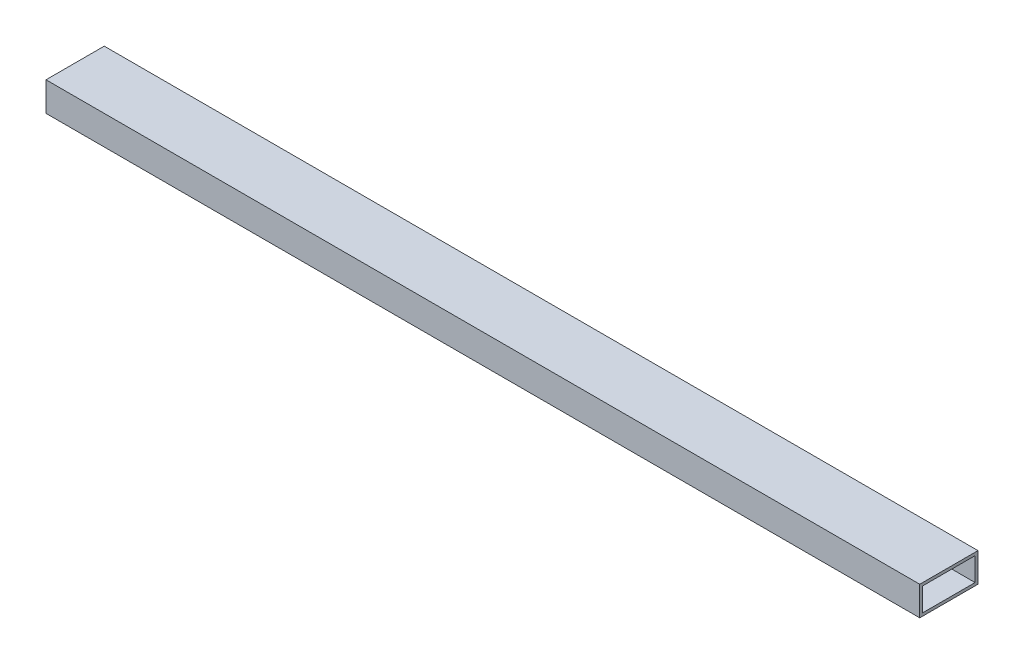
from build123d import *

# Parameters (mm, degrees)
SKETCH1_W           = 20
SKETCH1_H           = 10
SKETCH1_W_2         = 18
SKETCH1_H_2         = 8
BOSS_EXTRUDE1_DEPTH = 300


with BuildPart() as part:
    # Sketch1 → Boss-Extrude1 (new body)
    with BuildSketch(Plane(origin=(0, 0, 0), x_dir=(0, 0, -1), z_dir=(1, 0, 0))):
        Rectangle(SKETCH1_W, SKETCH1_H)
        Rectangle(SKETCH1_W_2, SKETCH1_H_2, mode=Mode.SUBTRACT)
    extrude(amount=BOSS_EXTRUDE1_DEPTH)


solid = part.part
